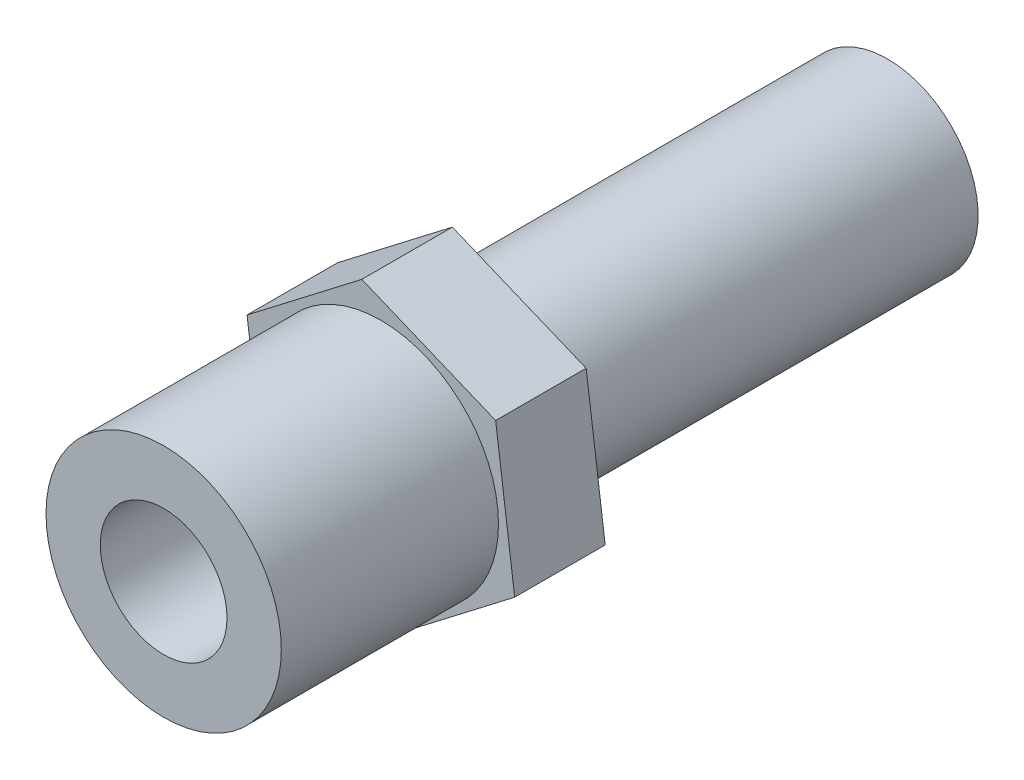
from build123d import *

# Parameters (mm, degrees)
SKETCH1_R           = 6.5
BOSS_EXTRUDE1_DEPTH = 12
BOSS_EXTRUDE2_DEPTH = 5
BOSS_EXTRUDE3_DEPTH = 23
SKETCH4_R           = 3.5
CUT_EXTRUDE1_DEPTH  = 42.443459209


with BuildPart() as part:
    # Sketch1 → Boss-Extrude1 (new body)
    with BuildSketch(Plane.XY):
        Circle(SKETCH1_R)
    extrude(amount=BOSS_EXTRUDE1_DEPTH)

    # Sketch2 → Boss-Extrude2 (add)
    with BuildSketch(Plane(origin=(0, 0, 0), x_dir=(-1, 0, 0), z_dir=(0, 0, -1))):
        Polygon((-7.393524213, -3.055454092), (-1.050661243, -7.930706838), (6.342862971, -4.875252746), (7.393524213, 3.055454092), (1.050661243, 7.930706838), (-6.342862971, 4.875252746), align=None)
    extrude(amount=BOSS_EXTRUDE2_DEPTH)

    # Sketch3 → Boss-Extrude3 (add)
    with BuildSketch(Plane(origin=(0, 0, -5), x_dir=(-1, 0, 0), z_dir=(0, 0, -1))):
        with BuildLine():
            ThreePointArc((4.620952633, 1.909658808), (-1.909658808, 4.620952633), (-4.620952633, -1.909658808))
            Line((-4.620952633, -1.909658808), (4.620952633, 1.909658808))
        make_face()
        with BuildLine():
            Line((4.620952633, 1.909658808), (-4.620952633, -1.909658808))
            ThreePointArc((-4.620952633, -1.909658808), (0.973456941, -4.904322745), (5, 0))
            ThreePointArc((5, 0), (4.904322745, 0.973456941), (4.620952633, 1.909658808))
        make_face()
    extrude(amount=BOSS_EXTRUDE3_DEPTH)

    # Sketch4 → Cut-Extrude1 (cut, through all)
    with BuildSketch(Plane.XY.offset(12)):
        Circle(SKETCH4_R)
    extrude(amount=-CUT_EXTRUDE1_DEPTH, mode=Mode.SUBTRACT)


solid = part.part
